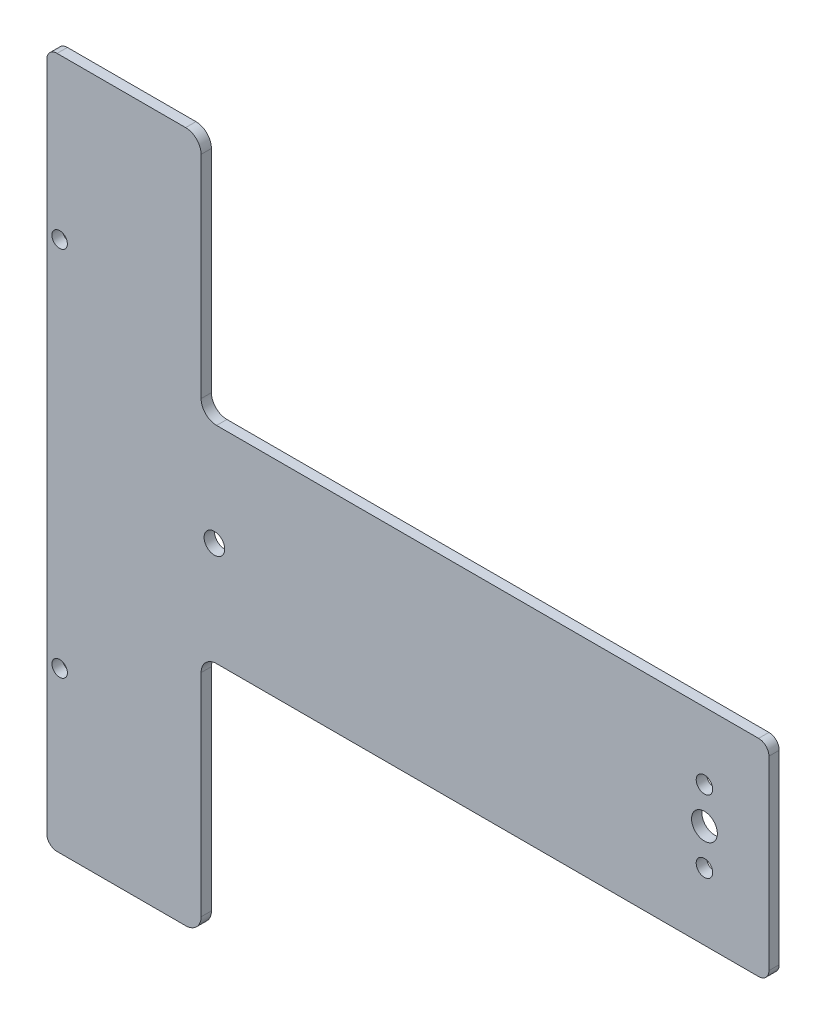
from build123d import *

# Parameters (mm, degrees)
EXTRUDE_1_DEPTH     = 2
SKETCH_2_R          = 2.5
SKETCH_2_R_2        = 2
SKETCH_2_R_3        = 1.5
CUT_EXTRUDE_1_DEPTH = 2
SKETCH_3_R          = 1.6
CUT_EXTRUDE_2_DEPTH = 2


with BuildPart() as part:
    # 草图1 → 凸台-拉伸1 (new body)
    with BuildSketch(Plane.XY.offset(45.656070911)):
        with BuildLine():
            Line((82.078378746, 65), (82.078378746, -65))
            ThreePointArc((82.078378746, -65), (82.664165184, -66.414213562), (84.078378746, -67))
            Line((84.078378746, -67), (109, -67))
            ThreePointArc((109, -67), (111.121320344, -66.121320344), (112, -64))
            Line((112, -64), (112, -23))
            ThreePointArc((112, -23), (112.878679656, -20.878679656), (115, -20))
            Line((115, -20), (220.078378746, -20))
            ThreePointArc((220.078378746, -20), (221.492592308, -19.414213562), (222.078378746, -18))
            Line((222.078378746, -18), (222.078378746, 18))
            ThreePointArc((222.078378746, 18), (221.492592308, 19.414213562), (220.078378746, 20))
            Line((220.078378746, 20), (115, 20))
            ThreePointArc((115, 20), (112.878679656, 20.878679656), (112, 23))
            Line((112, 23), (112, 64))
            ThreePointArc((112, 64), (111.121320344, 66.121320344), (109, 67))
            Line((109, 67), (84.078378746, 67))
            ThreePointArc((84.078378746, 67), (82.664165184, 66.414213562), (82.078378746, 65))
        make_face()
    extrude(amount=EXTRUDE_1_DEPTH)

    # 草图2 → 切除-拉伸1 (cut)
    with BuildSketch(Plane.XY.offset(45.656070911)):
        with Locations((209.578378746, 0)):
            Circle(SKETCH_2_R)
        with Locations((114.578378746, 0)):
            Circle(SKETCH_2_R_2)
        with Locations((84.578378746, -36)):
            Circle(SKETCH_2_R_3)
        with Locations((84.578378746, 36)):
            Circle(SKETCH_2_R_3)
    extrude(amount=CUT_EXTRUDE_1_DEPTH, mode=Mode.SUBTRACT)

    # 草图3 → 切除-拉伸2 (cut)
    with BuildSketch(Plane.XY.offset(45.656070911)):
        with Locations((209.57858663, -7)):
            Circle(SKETCH_3_R)
        with Locations((209.57858663, 7)):
            Circle(SKETCH_3_R)
    extrude(amount=CUT_EXTRUDE_2_DEPTH, mode=Mode.SUBTRACT)


solid = part.part
